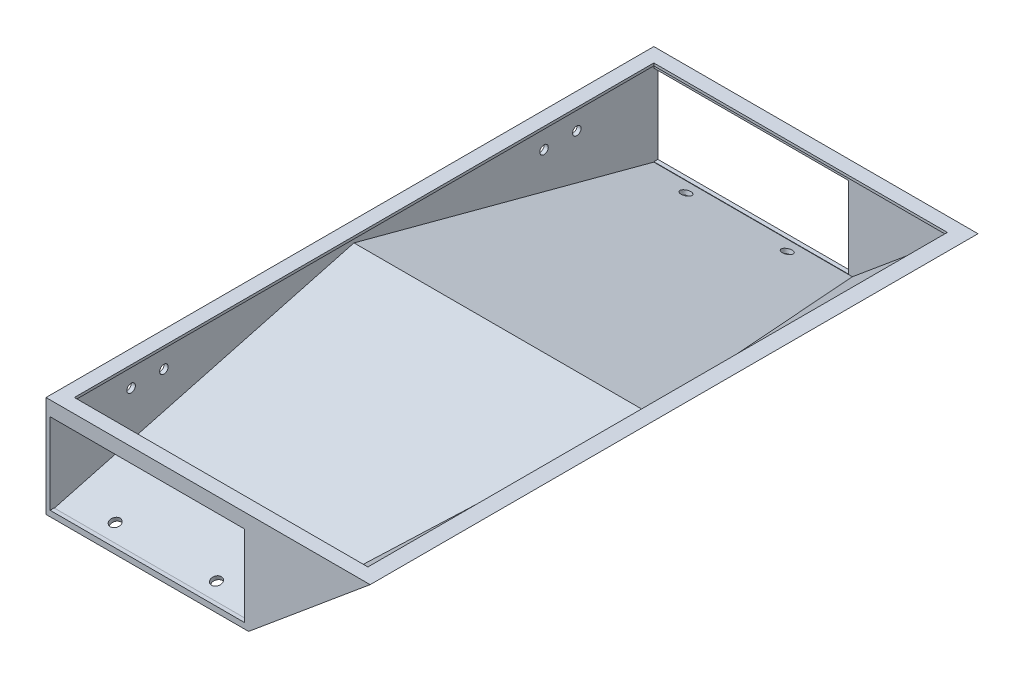
from build123d import *

# Parameters (mm, degrees)
BOSS_EXTRUDE1_DEPTH = 381
CUT_EXTRUDE1_DEPTH  = 304.8
SHELL1_T            = -2.54
SKETCH4_W           = 121.92
SKETCH4_H           = 50.8
CUT_EXTRUDE3_DEPTH  = 2.54
CUT_EXTRUDE4_START  = -381
SKETCH4_4_W         = 121.92
SKETCH4_4_H         = 50.8
CUT_EXTRUDE4_DEPTH  = 2.54
SKETCH5_R           = 3.175
CUT_EXTRUDE5_DEPTH  = 2.54
BOSS_EXTRUDE2_START = 63.5
SKETCH7_W           = 196.692393165
SKETCH7_H           = 375.92
BOSS_EXTRUDE2_DEPTH = 1.5875
SKETCH8_R           = 2.667
CUT_EXTRUDE6_DEPTH  = 2.54


with BuildPart() as part:
    # Sketch2 → Boss-Extrude1 (new body)
    with BuildSketch(Plane.XY):
        Polygon((0, 0), (127, 0), (203.2, 63.5), (0, 63.5), align=None)
    extrude(amount=BOSS_EXTRUDE1_DEPTH)

    # Sketch3 → Cut-Extrude1 (cut)
    with BuildSketch(Plane.ZY):
        Polygon((0, 0), (381, 0), (190.5, 50.8), align=None)
    extrude(amount=-CUT_EXTRUDE1_DEPTH, mode=Mode.SUBTRACT)

    # Shell1
    shell1_openings = [part.faces().sort_by_distance(p)[0] for p in [
        (101.6, 63.5, 190.5),
    ]]
    offset(amount=SHELL1_T, openings=shell1_openings, kind=Kind.INTERSECTION)

    # Sketch4 → Cut-Extrude3 (cut)
    with BuildSketch(Plane.XY.offset(381)):
        with Locations((63.5, 28.956)):
            Rectangle(SKETCH4_W, SKETCH4_H)
    extrude(amount=-CUT_EXTRUDE3_DEPTH, mode=Mode.SUBTRACT)

    # Sketch4<4> → Cut-Extrude4 (cut)
    with BuildSketch(Plane.XY.offset(381).offset(CUT_EXTRUDE4_START)):
        with Locations((63.5, 28.956)):
            Rectangle(SKETCH4_4_W, SKETCH4_4_H)
    extrude(amount=CUT_EXTRUDE4_DEPTH, mode=Mode.SUBTRACT)

    # Sketch5 → Cut-Extrude5 (cut)
    with BuildSketch(Plane(origin=(0, 94.854771784, 25.294605809), x_dir=(1, 0, 0), z_dir=(0, -0.9662349396012463, -0.2576626505603321))):
        with Locations(Location((31.75, 355.435511988, 0), (0, 0, 270))):
            Circle(SKETCH5_R)
        with Locations(Location((95.25, 355.435511988, 0), (0, 0, 270))):
            Circle(SKETCH5_R)
    cut_extrude5 = extrude(amount=-CUT_EXTRUDE5_DEPTH, mode=Mode.SUBTRACT)

    # Mirror1: Cut-Extrude5 across plane
    add(cut_extrude5.mirror(Plane.XY.offset(190.5)), mode=Mode.SUBTRACT)

    # Sketch7 → Boss-Extrude2 (add)
    with BuildSketch(Plane(origin=(0, 0, 0), x_dir=(1, 0, 0), z_dir=(0, 1, 0)).offset(BOSS_EXTRUDE2_START)):
        with Locations((100.886196583, -190.5)):
            Rectangle(SKETCH7_W, SKETCH7_H)
        Polygon((8.89, -372.11), (126.999705463, -372.11), (192.882393165, -372.11), (192.882393165, -8.89), (126.999705463, -8.89), (8.89, -8.89), (8.89, -190.5), align=None, mode=Mode.SUBTRACT)
    extrude(amount=-BOSS_EXTRUDE2_DEPTH)

    # Sketch8 → Cut-Extrude6 (cut)
    with BuildSketch(Plane.ZY):
        with Locations(Location((309.626, 44.45, 0), (0, 0, 270))):
            Circle(SKETCH8_R)
        with Locations(Location((330.2, 44.45, 0), (0, 0, 270))):
            Circle(SKETCH8_R)
    cut_extrude6 = extrude(amount=-CUT_EXTRUDE6_DEPTH, mode=Mode.SUBTRACT)

    # Mirror2: Cut-Extrude6 across plane
    add(cut_extrude6.mirror(Plane.XY.offset(190.5)), mode=Mode.SUBTRACT)


solid = part.part
